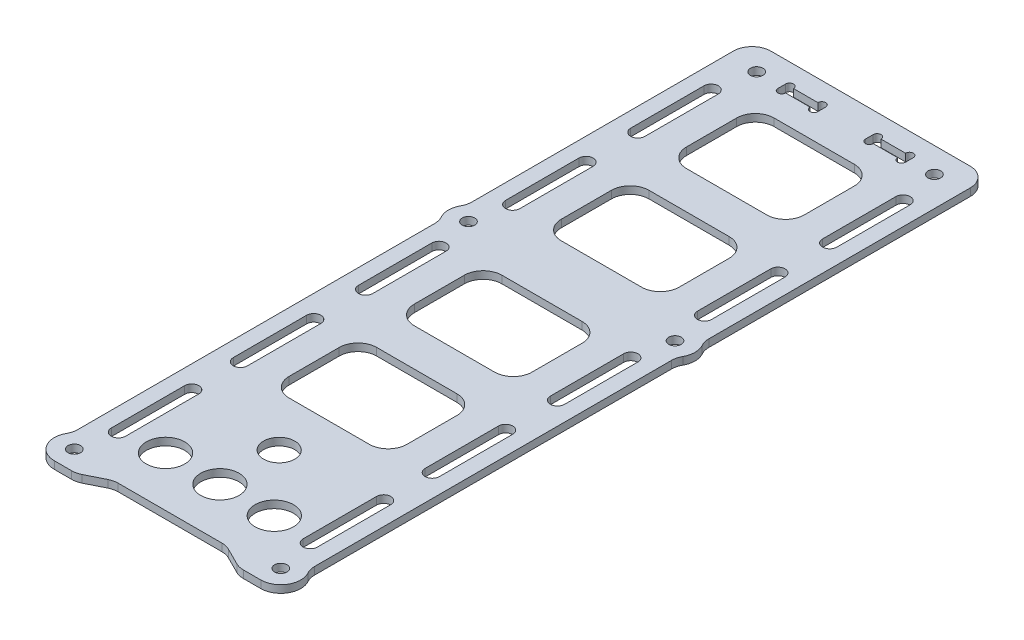
from build123d import *

# Parameters (mm, degrees)
SKETCH1_R                = 1.27
MAIN_BODY_DEPTH          = 1.524
SKETCH2_R                = 0.79375
SKETCH2_W                = 8.128
SKETCH2_H                = 1.5875
CAMERA_PLATE_SLOTS_DEPTH = 147.85864861
LONG_SLOT_CUTOUT_DEPTH   = 147.85864861
RECTANGLE_CUTOUT_DEPTH   = 147.85864861
LPATTERN1_COUNT          = 2
LPATTERN1_PITCH          = 25.4
LPATTERN1_COPY_1_DEPTH   = 147.85864861
LPATTERN2_COUNT          = 2
LPATTERN2_PITCH          = 55.245
LPATTERN2_COPY_1_DEPTH   = 147.85864861
LPATTERN2_COPY_2_DEPTH   = 147.85864861
LPATTERN2_COPY_3_DEPTH   = 147.85864861
LPATTERN2_COPY_4_DEPTH   = 147.85864861
LPATTERN3_COUNT          = 2
LPATTERN3_PITCH          = 105.41
LPATTERN3_COPY_1_DEPTH   = 147.85864861
SKETCH5_R                = 3.8989
SKETCH5_R_2              = 3.175
ROUND_CUTOUTS_DEPTH      = 147.85864861
FILLET1_R                = 3.81


with BuildPart() as part:
    # Sketch1 → MAIN BODY (new body)
    # profile 1 of 9: a face of its own
    with BuildSketch(Plane(origin=(0, 0, 0), x_dir=(1, 0, 0), z_dir=(0, 1, 0))):
        with BuildLine():
            Line((-20.955, -144.7038), (-16.51, -144.7038))
            Line((-16.51, -144.7038), (-11.43, -142.1638))
            Line((-11.43, -142.1638), (11.43, -142.1638))
            Line((11.43, -142.1638), (16.51, -144.7038))
            Line((16.51, -144.7038), (20.955, -144.7038))
            ThreePointArc((20.955, -144.7038), (17.262958085, -138.941294039), (24.0411, -137.995545324))
            Line((24.0411, -137.995545324), (24.0411, -63.286754676))
            ThreePointArc((24.0411, -63.286754676), (16.891, -60.6425), (24.0411, -57.998245324))
            Line((24.0411, -57.998245324), (24.0411, -3.81))
            ThreePointArc((24.0411, -3.81), (22.925176836, -1.115923164), (20.2311, 0))
            Line((20.2311, 0), (-20.2311, 0))
            ThreePointArc((-20.2311, 0), (-22.925176836, -1.115923164), (-24.0411, -3.81))
            Line((-24.0411, -3.81), (-24.0411, -57.998245324))
            ThreePointArc((-24.0411, -57.998245324), (-19.545357208, -56.830807043), (-16.891, -60.6425))
            ThreePointArc((-16.891, -60.6425), (-19.545357208, -64.454192957), (-24.0411, -63.286754676))
            Line((-24.0411, -63.286754676), (-24.0411, -137.995545324))
            ThreePointArc((-24.0411, -137.995545324), (-19.545357208, -136.828107043), (-16.891, -140.6398))
            ThreePointArc((-16.891, -140.6398), (-18.081318041, -143.513481959), (-20.955, -144.7038))
        make_face()
        with Locations(Location((-18.034, -5.08, 0), (0, 0, 90))):
            Circle(SKETCH1_R, mode=Mode.SUBTRACT)
        with Locations(Location((18.034, -5.08, 0), (0, 0, 90))):
            Circle(SKETCH1_R, mode=Mode.SUBTRACT)
    # profile 2 of 9: a face of its own
    with BuildSketch(Plane(origin=(0, 0, 0), x_dir=(1, 0, 0), z_dir=(0, 1, 0))):
        with BuildLine():
            Line((-24.0411, -57.998245324), (-24.0411, -63.286754676))
            ThreePointArc((-24.0411, -63.286754676), (-19.545357208, -64.454192957), (-16.891, -60.6425))
            ThreePointArc((-16.891, -60.6425), (-19.545357208, -56.830807043), (-24.0411, -57.998245324))
        make_face()
        with Locations(Location((-20.955, -60.6425, 0), (0, 0, 90))):
            Circle(SKETCH1_R, mode=Mode.SUBTRACT)
    # profile 3 of 9: a face of its own
    with BuildSketch(Plane(origin=(0, 0, 0), x_dir=(1, 0, 0), z_dir=(0, 1, 0))):
        with BuildLine():
            ThreePointArc((-24.0411, -57.998245324), (-25.019, -60.6425), (-24.0411, -63.286754676))
            Line((-24.0411, -63.286754676), (-24.0411, -57.998245324))
        make_face()
    # profile 4 of 9: a face of its own
    with BuildSketch(Plane(origin=(0, 0, 0), x_dir=(1, 0, 0), z_dir=(0, 1, 0))):
        with BuildLine():
            Line((24.0411, -57.998245324), (24.0411, -63.286754676))
            ThreePointArc((24.0411, -63.286754676), (24.766692957, -62.052142792), (25.019, -60.6425))
            ThreePointArc((25.019, -60.6425), (24.766692957, -59.232857208), (24.0411, -57.998245324))
        make_face()
    # profile 5 of 9: a face of its own
    with BuildSketch(Plane(origin=(0, 0, 0), x_dir=(1, 0, 0), z_dir=(0, 1, 0))):
        with BuildLine():
            ThreePointArc((24.0411, -57.998245324), (16.891, -60.6425), (24.0411, -63.286754676))
            Line((24.0411, -63.286754676), (24.0411, -57.998245324))
        make_face()
        with Locations(Location((20.955, -60.6425, 0), (0, 0, 90))):
            Circle(SKETCH1_R, mode=Mode.SUBTRACT)
    # profile 6 of 9: a face of its own
    with BuildSketch(Plane(origin=(0, 0, 0), x_dir=(1, 0, 0), z_dir=(0, 1, 0))):
        with BuildLine():
            ThreePointArc((-24.0411, -143.284054676), (-22.653505961, -144.331841915), (-20.955, -144.7038))
            ThreePointArc((-20.955, -144.7038), (-18.081318041, -143.513481959), (-16.891, -140.6398))
            ThreePointArc((-16.891, -140.6398), (-19.545357208, -136.828107043), (-24.0411, -137.995545324))
            Line((-24.0411, -137.995545324), (-24.0411, -143.284054676))
        make_face()
        with Locations(Location((-20.955, -140.6398, 0), (0, 0, 90))):
            Circle(SKETCH1_R, mode=Mode.SUBTRACT)
    # profile 7 of 9: a face of its own
    with BuildSketch(Plane(origin=(0, 0, 0), x_dir=(1, 0, 0), z_dir=(0, 1, 0))):
        with BuildLine():
            ThreePointArc((-24.0411, -137.995545324), (-25.019, -140.6398), (-24.0411, -143.284054676))
            Line((-24.0411, -143.284054676), (-24.0411, -137.995545324))
        make_face()
    # profile 8 of 9: a face of its own
    with BuildSketch(Plane(origin=(0, 0, 0), x_dir=(1, 0, 0), z_dir=(0, 1, 0))):
        with BuildLine():
            ThreePointArc((24.0411, -137.995545324), (17.262958085, -138.941294039), (20.955, -144.7038))
            ThreePointArc((20.955, -144.7038), (22.653505961, -144.331841915), (24.0411, -143.284054676))
            Line((24.0411, -143.284054676), (24.0411, -137.995545324))
        make_face()
        with Locations(Location((20.955, -140.6398, 0), (0, 0, 90))):
            Circle(SKETCH1_R, mode=Mode.SUBTRACT)
    # profile 9 of 9: a face of its own
    with BuildSketch(Plane(origin=(0, 0, 0), x_dir=(1, 0, 0), z_dir=(0, 1, 0))):
        with BuildLine():
            ThreePointArc((25.019, -140.6398), (24.766692957, -139.230157208), (24.0411, -137.995545324))
            Line((24.0411, -137.995545324), (24.0411, -143.284054676))
            ThreePointArc((24.0411, -143.284054676), (24.766692957, -142.049442792), (25.019, -140.6398))
        make_face()
    extrude(amount=MAIN_BODY_DEPTH)

    # Sketch2 → CAMERA PLATE SLOTS (cut, through all)
    with BuildSketch(Plane(origin=(0, 1.524, 0), x_dir=(1, 0, 0), z_dir=(0, 1, 0))):
        with Locations((5.61975, -5.87375)):
            Circle(SKETCH2_R)
        with Locations((5.61975, -4.28625)):
            Circle(SKETCH2_R)
        with Locations((12.16025, -4.28625)):
            Circle(SKETCH2_R)
        with Locations((12.16025, -5.87375)):
            Circle(SKETCH2_R)
        with Locations((8.89, -5.08)):
            Rectangle(SKETCH2_W, SKETCH2_H)
    camera_plate_slots = extrude(amount=-CAMERA_PLATE_SLOTS_DEPTH, mode=Mode.SUBTRACT)

    # Mirror2: CAMERA PLATE SLOTS across plane
    add(camera_plate_slots.mirror(Plane(origin=(0, 0, 0), x_dir=(0, 0, 1), z_dir=(1, 0, 0))), mode=Mode.SUBTRACT)

    # Sketch4 → LONG SLOT CUTOUT (cut, through all)
    with BuildSketch(Plane(origin=(0, 1.524, 0), x_dir=(1, 0, 0), z_dir=(0, 1, 0))):
        with BuildLine():
            Line((20.9169, -12.8778), (20.9169, -27.7622))
            ThreePointArc((20.9169, -27.7622), (19.4691, -29.21), (18.0213, -27.7622))
            Line((18.0213, -27.7622), (18.0213, -12.8778))
            ThreePointArc((18.0213, -12.8778), (19.4691, -11.43), (20.9169, -12.8778))
        make_face()
    long_slot_cutout = extrude(amount=-LONG_SLOT_CUTOUT_DEPTH, mode=Mode.SUBTRACT)

    # Mirror1: LONG SLOT CUTOUT across plane
    add(long_slot_cutout.mirror(Plane(origin=(0, 0, 0), x_dir=(0, 0, 1), z_dir=(1, 0, 0))), mode=Mode.SUBTRACT)

    # Sketch3 → RECTANGLE CUTOUT (cut, through all)
    with BuildSketch(Plane(origin=(0, 1.524, 0), x_dir=(1, 0, 0), z_dir=(0, 1, 0))):
        with BuildLine():
            Line((-8.1407, -29.21), (8.1407, -29.21))
            ThreePointArc((8.1407, -29.21), (10.834776836, -28.094076836), (11.9507, -25.4))
            Line((11.9507, -25.4), (11.9507, -15.24))
            ThreePointArc((11.9507, -15.24), (10.834776836, -12.545923164), (8.1407, -11.43))
            Line((8.1407, -11.43), (-8.1407, -11.43))
            ThreePointArc((-8.1407, -11.43), (-10.834776836, -12.545923164), (-11.9507, -15.24))
            Line((-11.9507, -15.24), (-11.9507, -25.4))
            ThreePointArc((-11.9507, -25.4), (-10.834776836, -28.094076836), (-8.1407, -29.21))
        make_face()
    rectangle_cutout = extrude(amount=-RECTANGLE_CUTOUT_DEPTH, mode=Mode.SUBTRACT)

    # LPattern1: LONG SLOT CUTOUT, RECTANGLE CUTOUT ×2
    with Locations(*[(0, 0, i * LPATTERN1_PITCH) for i in range(1, LPATTERN1_COUNT)]):
        add(long_slot_cutout, mode=Mode.SUBTRACT)
        add(rectangle_cutout, mode=Mode.SUBTRACT)

    # LPattern1 copy 1 sketch → LPattern1 copy 1 (cut, through all)
    with BuildSketch(Plane(origin=(0, 1.524, 25.4), x_dir=(-1, 0, 0), z_dir=(0, 1, 0))):
        with BuildLine():
            Line((20.9169, 12.8778), (20.9169, 27.7622))
            ThreePointArc((20.9169, 27.7622), (19.4691, 29.21), (18.0213, 27.7622))
            Line((18.0213, 27.7622), (18.0213, 12.8778))
            ThreePointArc((18.0213, 12.8778), (19.4691, 11.43), (20.9169, 12.8778))
        make_face()
    extrude(amount=-LPATTERN1_COPY_1_DEPTH, mode=Mode.SUBTRACT)

    # LPattern2: LONG SLOT CUTOUT, RECTANGLE CUTOUT ×2
    with Locations(*[(0, 0, i * LPATTERN2_PITCH) for i in range(1, LPATTERN2_COUNT)]):
        add(long_slot_cutout, mode=Mode.SUBTRACT)
        add(rectangle_cutout, mode=Mode.SUBTRACT)

    # LPattern2 copy 1 sketch → LPattern2 copy 1 (cut, through all)
    with BuildSketch(Plane(origin=(0, 1.524, 55.245), x_dir=(-1, 0, 0), z_dir=(0, 1, 0))):
        with BuildLine():
            Line((20.9169, 12.8778), (20.9169, 27.7622))
            ThreePointArc((20.9169, 27.7622), (19.4691, 29.21), (18.0213, 27.7622))
            Line((18.0213, 27.7622), (18.0213, 12.8778))
            ThreePointArc((18.0213, 12.8778), (19.4691, 11.43), (20.9169, 12.8778))
        make_face()
    extrude(amount=-LPATTERN2_COPY_1_DEPTH, mode=Mode.SUBTRACT)

    # LPattern2 copy 2 sketch → LPattern2 copy 2 (cut, through all)
    with BuildSketch(Plane(origin=(0, 1.524, 80.645), x_dir=(1, 0, 0), z_dir=(0, 1, 0))):
        with BuildLine():
            Line((20.9169, -12.8778), (20.9169, -27.7622))
            ThreePointArc((20.9169, -27.7622), (19.4691, -29.21), (18.0213, -27.7622))
            Line((18.0213, -27.7622), (18.0213, -12.8778))
            ThreePointArc((18.0213, -12.8778), (19.4691, -11.43), (20.9169, -12.8778))
        make_face()
    extrude(amount=-LPATTERN2_COPY_2_DEPTH, mode=Mode.SUBTRACT)

    # LPattern2 copy 3 sketch → LPattern2 copy 3 (cut, through all)
    with BuildSketch(Plane(origin=(0, 1.524, 80.645), x_dir=(1, 0, 0), z_dir=(0, 1, 0))):
        with BuildLine():
            Line((-8.1407, -29.21), (8.1407, -29.21))
            ThreePointArc((8.1407, -29.21), (10.834776836, -28.094076836), (11.9507, -25.4))
            Line((11.9507, -25.4), (11.9507, -15.24))
            ThreePointArc((11.9507, -15.24), (10.834776836, -12.545923164), (8.1407, -11.43))
            Line((8.1407, -11.43), (-8.1407, -11.43))
            ThreePointArc((-8.1407, -11.43), (-10.834776836, -12.545923164), (-11.9507, -15.24))
            Line((-11.9507, -15.24), (-11.9507, -25.4))
            ThreePointArc((-11.9507, -25.4), (-10.834776836, -28.094076836), (-8.1407, -29.21))
        make_face()
    extrude(amount=-LPATTERN2_COPY_3_DEPTH, mode=Mode.SUBTRACT)

    # LPattern2 copy 4 sketch → LPattern2 copy 4 (cut, through all)
    with BuildSketch(Plane(origin=(0, 1.524, 80.645), x_dir=(-1, 0, 0), z_dir=(0, 1, 0))):
        with BuildLine():
            Line((20.9169, 12.8778), (20.9169, 27.7622))
            ThreePointArc((20.9169, 27.7622), (19.4691, 29.21), (18.0213, 27.7622))
            Line((18.0213, 27.7622), (18.0213, 12.8778))
            ThreePointArc((18.0213, 12.8778), (19.4691, 11.43), (20.9169, 12.8778))
        make_face()
    extrude(amount=-LPATTERN2_COPY_4_DEPTH, mode=Mode.SUBTRACT)

    # LPattern3: LONG SLOT CUTOUT ×2
    with Locations(*[(0, 0, i * LPATTERN3_PITCH) for i in range(1, LPATTERN3_COUNT)]):
        add(long_slot_cutout, mode=Mode.SUBTRACT)

    # LPattern3 copy 1 sketch → LPattern3 copy 1 (cut, through all)
    with BuildSketch(Plane(origin=(0, 1.524, 105.41), x_dir=(-1, 0, 0), z_dir=(0, 1, 0))):
        with BuildLine():
            Line((20.9169, 12.8778), (20.9169, 27.7622))
            ThreePointArc((20.9169, 27.7622), (19.4691, 29.21), (18.0213, 27.7622))
            Line((18.0213, 27.7622), (18.0213, 12.8778))
            ThreePointArc((18.0213, 12.8778), (19.4691, 11.43), (20.9169, 12.8778))
        make_face()
    extrude(amount=-LPATTERN3_COPY_1_DEPTH, mode=Mode.SUBTRACT)

    # Sketch5 → ROUND CUTOUTS (cut, through all)
    with BuildSketch(Plane(origin=(0, 1.524, 0), x_dir=(1, 0, 0), z_dir=(0, 1, 0))):
        with Locations(Location((0, -132.0419, 0), (0, 0, 270))):
            Circle(SKETCH5_R)
        with Locations(Location((11.0363, -132.0419, 0), (0, 0, 270))):
            Circle(SKETCH5_R)
        with Locations(Location((-11.0363, -132.0419, 0), (0, 0, 270))):
            Circle(SKETCH5_R)
        with Locations(Location((0, -120.015, 0), (0, 0, 270))):
            Circle(SKETCH5_R_2)
    extrude(amount=-ROUND_CUTOUTS_DEPTH, mode=Mode.SUBTRACT)

    # Fillet1
    fillet1_edges = [part.edges().sort_by_distance(p)[0] for p in [
        (24.0411, 0.762, 57.998245324),
        (24.0411, 0.762, 63.286754676),
        (24.0411, 0.762, 137.995545324),
        (16.51, 0.762, 144.7038),
        (11.43, 0.762, 142.1638),
        (-11.43, 0.762, 142.1638),
        (-16.51, 0.762, 144.7038),
        (-24.0411, 0.762, 137.995545324),
        (-24.0411, 0.762, 63.286754676),
        (-24.0411, 0.762, 57.998245324),
    ]]
    fillet(fillet1_edges, radius=FILLET1_R)


solid = part.part
